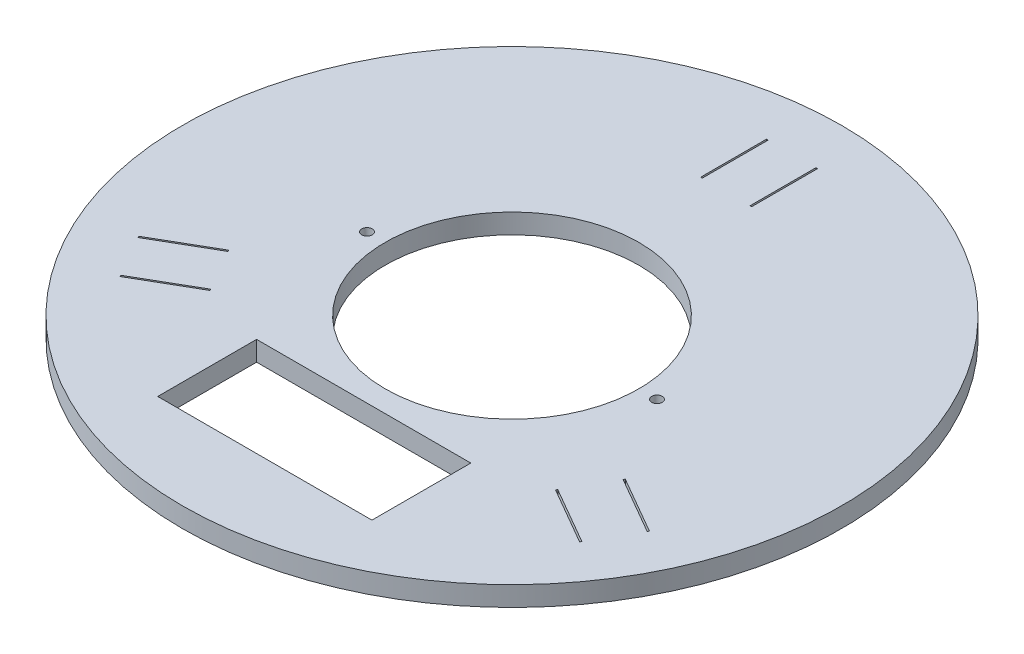
from build123d import *

# Parameters (mm, degrees)
SKETCH2_R           = 100
BOSS_EXTRUDE1_DEPTH = 6
SKETCH3_W           = 0.5
SKETCH3_H           = 20
CUT_EXTRUDE1_DEPTH  = 142.548578234
SKETCH4_R           = 38.5
CUT_EXTRUDE2_DEPTH  = 142.548578234
SKETCH5_R           = 1.6
CUT_EXTRUDE3_DEPTH  = 142.548578234
SKETCH6_W           = 65
SKETCH6_H           = 30
CUT_EXTRUDE4_DEPTH  = 142.548578234


with BuildPart() as part:
    # Sketch2 → Boss-Extrude1 (new body)
    with BuildSketch(Plane(origin=(0, 0, 0), x_dir=(1, 0, 0), z_dir=(0, 1, 0))):
        with Locations(Location((0, 0, 0), (0, 0, 270))):
            Circle(SKETCH2_R)
    extrude(amount=BOSS_EXTRUDE1_DEPTH)

    # Sketch3 → Cut-Extrude1 (cut, through all)
    with BuildSketch(Plane(origin=(0, 6, 0), x_dir=(1, 0, 0), z_dir=(0, 1, 0))):
        with Locations((-7.5, 75)):
            Rectangle(SKETCH3_W, SKETCH3_H)
        with Locations((7.5, 75)):
            Rectangle(SKETCH3_W, SKETCH3_H)
        Polygon((60.166651246, -25.788303121), (77.487159322, -35.788303121), (77.237159322, -36.221315823), (59.916651246, -26.221315823), align=None)
        Polygon((52.666651246, -38.778684177), (69.987159322, -48.778684177), (69.737159322, -49.211696879), (52.416651246, -39.211696879), align=None)
        Polygon((-52.416651246, -39.211696879), (-69.737159322, -49.211696879), (-69.987159322, -48.778684177), (-52.666651246, -38.778684177), align=None)
        Polygon((-59.916651246, -26.221315823), (-77.237159322, -36.221315823), (-77.487159322, -35.788303121), (-60.166651246, -25.788303121), align=None)
    extrude(amount=-CUT_EXTRUDE1_DEPTH, mode=Mode.SUBTRACT)

    # Sketch4 → Cut-Extrude2 (cut, through all)
    with BuildSketch(Plane(origin=(0, 6, 0), x_dir=(1, 0, 0), z_dir=(0, 1, 0))):
        with Locations(Location((0, 0, 0), (0, 0, 270))):
            Circle(SKETCH4_R)
    extrude(amount=-CUT_EXTRUDE2_DEPTH, mode=Mode.SUBTRACT)

    # Sketch5 → Cut-Extrude3 (cut, through all)
    with BuildSketch(Plane(origin=(0, 6, 0), x_dir=(1, 0, 0), z_dir=(0, 1, 0))):
        with Locations(Location((-44, 0, 0), (0, 0, 270))):
            Circle(SKETCH5_R)
        with Locations(Location((44, 0, 0), (0, 0, 270))):
            Circle(SKETCH5_R)
    extrude(amount=-CUT_EXTRUDE3_DEPTH, mode=Mode.SUBTRACT)

    # Sketch6 → Cut-Extrude4 (cut, through all)
    with BuildSketch(Plane(origin=(0, 6, 0), x_dir=(1, 0, 0), z_dir=(0, 1, 0))):
        with Locations((0, -60)):
            Rectangle(SKETCH6_W, SKETCH6_H)
    extrude(amount=-CUT_EXTRUDE4_DEPTH, mode=Mode.SUBTRACT)


solid = part.part
